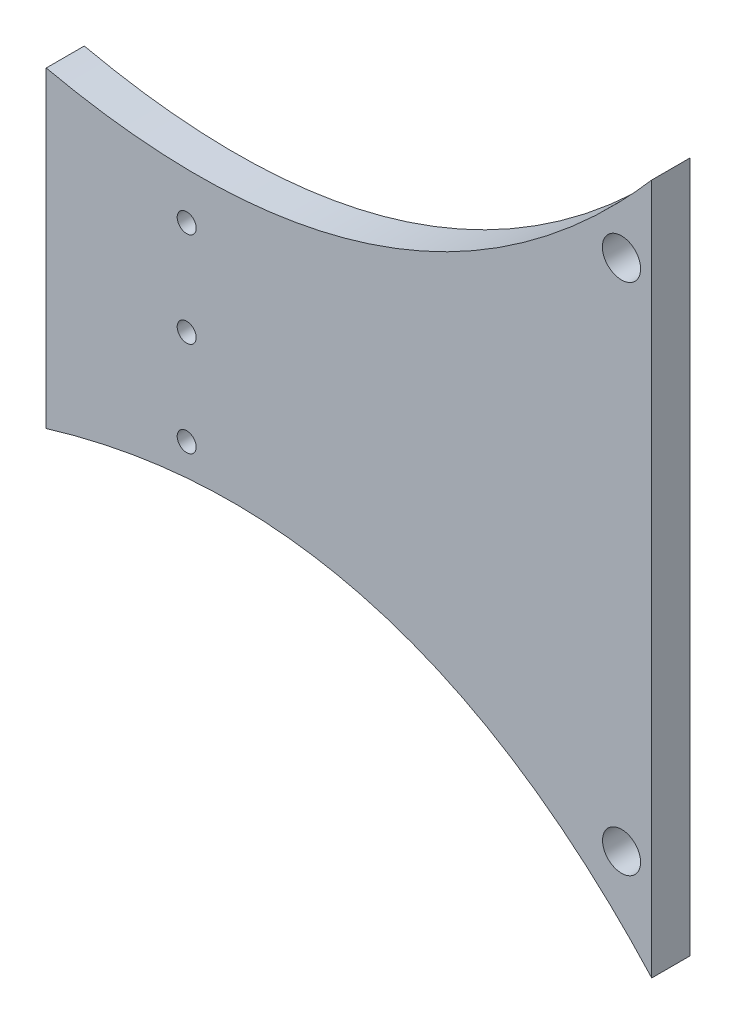
from build123d import *

# Parameters (mm, degrees)
SKETCH1_R           = 0.5
SKETCH1_R_2         = 1.004584714
SKETCH1_R_3         = 1
BOSS_EXTRUDE4_DEPTH = 2


with BuildPart() as part:
    # Sketch1 → Boss-Extrude4 (new body)
    with BuildSketch(Plane.XY):
        with BuildLine():
            Line((0, 6.796629536), (0, 23.203370382))
            add(Edge.make_bspline(
                [(0, 23.203370382), (18.824108825, 19.022876047), (31.816291347, 34.013726018)],
                knots=[0, 0, 0, 1, 1, 1], degree=2))
            Line((31.816291347, 34.013726018), (31.816291347, -2.297085155))
            add(Edge.make_bspline(
                [(0, 6.796629536), (18.47321861, 12.396952678), (31.816291347, -2.297085155)],
                knots=[0, 0, 0, 1, 1, 1], degree=2))
        make_face()
        with Locations((7.382147853, 19.853448191)):
            Circle(SKETCH1_R, mode=Mode.SUBTRACT)
        with Locations((7.382147853, 9.889606803)):
            Circle(SKETCH1_R, mode=Mode.SUBTRACT)
        with Locations((7.382147853, 14.871527497)):
            Circle(SKETCH1_R, mode=Mode.SUBTRACT)
        with Locations((30.227051082, 29.675836966)):
            Circle(SKETCH1_R_2, mode=Mode.SUBTRACT)
        with Locations((30.230334009, 2.675837166)):
            Circle(SKETCH1_R_3, mode=Mode.SUBTRACT)
    extrude(amount=BOSS_EXTRUDE4_DEPTH)


solid = part.part
